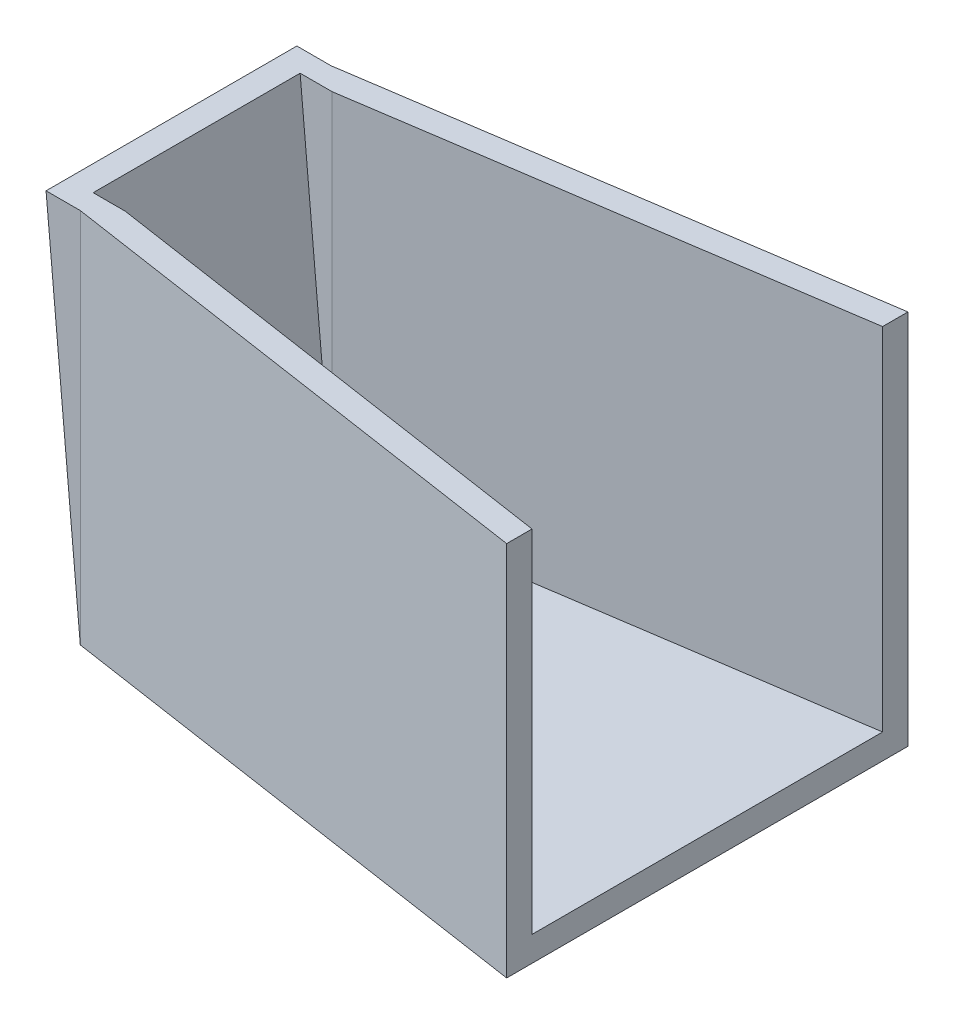
from build123d import *

# Parameters (mm, degrees)
BOSS_EXTRUDE1_DEPTH = 3
BOSS_EXTRUDE2_DEPTH = 15
BOSS_EXTRUDE3_DEPTH = 42
SKETCH6_W           = 2.622655796
SKETCH6_H           = 42
SKETCH6_H_2         = 45
BOSS_EXTRUDE4_DEPTH = 4
CUT_EXTRUDE1_DEPTH  = 88.488342941


with BuildPart() as part:
    # Sketch1 → Boss-Extrude1 (new body)
    with BuildSketch(Plane(origin=(0, 0, 0), x_dir=(1, 0, 0), z_dir=(0, 1, 0))):
        Polygon((-60, 0), (0, 0), (0, 24), (-60, 15), align=None)
        Polygon((-60, -15), (0, -24), (0, 0), (-60, 0), align=None)
    extrude(amount=BOSS_EXTRUDE1_DEPTH)

    # Sketch3 → Boss-Extrude2 (add, symmetric)
    with BuildSketch(Plane.XY):
        Polygon((-64.095320817, 45), (-61.082922988, 45), (-56.987602171, 0), (-60, 0), align=None)
    extrude(amount=BOSS_EXTRUDE2_DEPTH, both=True)

    # Sketch4 → Boss-Extrude3 (add)
    with BuildSketch(Plane(origin=(0, 3, 0), x_dir=(1, 0, 0), z_dir=(0, 1, 0))):
        Polygon((-57.260623559, 12.377344204), (0, 20.966437738), (0, 24), (-60, 15), (-57.260623559, 15), align=None)
        Polygon((0, -24), (0, -20.966437738), (-57.260623559, -12.377344204), (-57.260623559, -15), (-60, -15), align=None)
    extrude(amount=BOSS_EXTRUDE3_DEPTH)

    # Sketch6 → Boss-Extrude4 (add)
    with BuildSketch(Plane.ZY.offset(57.260623559)):
        with Locations((-13.688672102, 24)):
            Rectangle(SKETCH6_W, SKETCH6_H)
        with Locations((13.688672102, 22.5)):
            Rectangle(SKETCH6_W, SKETCH6_H_2)
    extrude(amount=BOSS_EXTRUDE4_DEPTH)

    # Sketch7 → Cut-Extrude1 (cut, through all)
    with BuildSketch(Plane.XY.offset(15)):
        Polygon((-61.260623559, 13.851920935), (-60, 0), (-61.260623559, 0), align=None)
    extrude(amount=-CUT_EXTRUDE1_DEPTH, mode=Mode.SUBTRACT)


solid = part.part
